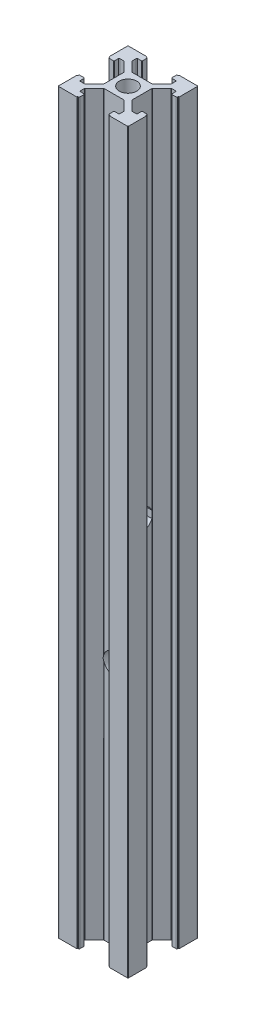
from build123d import *

# Parameters (mm, degrees)
SKETCH1_R               = 2.5
BOSS_EXTRUDE1_DEPTH     = 211
CUT_EXTRUDE1_DEPTH      = 10
CUT_EXTRUDE1_DEPTH_BACK = 10
CUT_EXTRUDE2_DEPTH      = 10
CUT_EXTRUDE2_DEPTH_BACK = 10
SKETCH4_R               = 3


with BuildPart() as part:
    # Sketch1 → Boss-Extrude1 (new body)
    with BuildSketch(Plane(origin=(0, 0, 0), x_dir=(1, 0, 0), z_dir=(0, 1, 0))):
        with BuildLine():
            Line((-10, 4.65), (-9.8, 4.65))
            Line((-9.8, 4.65), (-9.8, 4.4))
            ThreePointArc((-9.8, 4.4), (-9.741421356, 4.258578644), (-9.6, 4.2))
            Line((-9.6, 4.2), (-8.4, 4.2))
            ThreePointArc((-8.4, 4.2), (-8.258578644, 4.258578644), (-8.2, 4.4))
            Line((-8.2, 4.4), (-8.2, 5.45))
            ThreePointArc((-8.2, 5.45), (-8.141421356, 5.591421356), (-8, 5.65))
            Line((-8, 5.65), (-6.832842712, 5.65))
            ThreePointArc((-6.832842712, 5.65), (-6.756306026, 5.634775907), (-6.691421356, 5.591421356))
            Line((-6.691421356, 5.591421356), (-4.058578644, 2.958578644))
            ThreePointArc((-4.058578644, 2.958578644), (-4.015224093, 2.893693974), (-4, 2.817157288))
            Line((-4, 2.817157288), (-4, -2.817157288))
            ThreePointArc((-4, -2.817157288), (-4.015224093, -2.893693974), (-4.058578644, -2.958578644))
            Line((-4.058578644, -2.958578644), (-6.691421356, -5.591421356))
            ThreePointArc((-6.691421356, -5.591421356), (-6.756306026, -5.634775907), (-6.832842712, -5.65))
            Line((-6.832842712, -5.65), (-8, -5.65))
            ThreePointArc((-8, -5.65), (-8.141421356, -5.591421356), (-8.2, -5.45))
            Line((-8.2, -5.45), (-8.2, -4.4))
            ThreePointArc((-8.2, -4.4), (-8.258578644, -4.258578644), (-8.4, -4.2))
            Line((-8.4, -4.2), (-9.6, -4.2))
            ThreePointArc((-9.6, -4.2), (-9.741421356, -4.258578644), (-9.8, -4.4))
            Line((-9.8, -4.4), (-9.8, -4.65))
            Line((-9.8, -4.65), (-10, -4.65))
            Line((-10, -4.65), (-10, -9.8))
            ThreePointArc((-10, -9.8), (-9.941421356, -9.941421356), (-9.8, -10))
            Line((-9.8, -10), (-4.65, -10))
            Line((-4.65, -10), (-4.65, -9.8))
            Line((-4.65, -9.8), (-4.4, -9.8))
            ThreePointArc((-4.4, -9.8), (-4.258578644, -9.741421356), (-4.2, -9.6))
            Line((-4.2, -9.6), (-4.2, -8.4))
            ThreePointArc((-4.2, -8.4), (-4.258578644, -8.258578644), (-4.4, -8.2))
            Line((-4.4, -8.2), (-5.45, -8.2))
            ThreePointArc((-5.45, -8.2), (-5.591421356, -8.141421356), (-5.65, -8))
            Line((-5.65, -8), (-5.65, -6.832842712))
            ThreePointArc((-5.65, -6.832842712), (-5.634775907, -6.756306026), (-5.591421356, -6.691421356))
            Line((-5.591421356, -6.691421356), (-2.958578644, -4.058578644))
            ThreePointArc((-2.958578644, -4.058578644), (-2.893693974, -4.015224093), (-2.817157288, -4))
            Line((-2.817157288, -4), (2.817157288, -4))
            ThreePointArc((2.817157288, -4), (2.893693974, -4.015224093), (2.958578644, -4.058578644))
            Line((2.958578644, -4.058578644), (5.591421356, -6.691421356))
            ThreePointArc((5.591421356, -6.691421356), (5.634775907, -6.756306026), (5.65, -6.832842712))
            Line((5.65, -6.832842712), (5.65, -8))
            ThreePointArc((5.65, -8), (5.591421356, -8.141421356), (5.45, -8.2))
            Line((5.45, -8.2), (4.4, -8.2))
            ThreePointArc((4.4, -8.2), (4.258578644, -8.258578644), (4.2, -8.4))
            Line((4.2, -8.4), (4.2, -9.6))
            ThreePointArc((4.2, -9.6), (4.258578644, -9.741421356), (4.4, -9.8))
            Line((4.4, -9.8), (4.65, -9.8))
            Line((4.65, -9.8), (4.65, -10))
            Line((4.65, -10), (9.8, -10))
            ThreePointArc((9.8, -10), (9.941421356, -9.941421356), (10, -9.8))
            Line((10, -9.8), (10, -4.65))
            Line((10, -4.65), (9.8, -4.65))
            Line((9.8, -4.65), (9.8, -4.4))
            ThreePointArc((9.8, -4.4), (9.741421356, -4.258578644), (9.6, -4.2))
            Line((9.6, -4.2), (8.4, -4.2))
            ThreePointArc((8.4, -4.2), (8.258578644, -4.258578644), (8.2, -4.4))
            Line((8.2, -4.4), (8.2, -5.45))
            ThreePointArc((8.2, -5.45), (8.141421356, -5.591421356), (8, -5.65))
            Line((8, -5.65), (6.832842712, -5.65))
            ThreePointArc((6.832842712, -5.65), (6.756306026, -5.634775907), (6.691421356, -5.591421356))
            Line((6.691421356, -5.591421356), (4.058578644, -2.958578644))
            ThreePointArc((4.058578644, -2.958578644), (4.015224093, -2.893693974), (4, -2.817157288))
            Line((4, -2.817157288), (4, 2.817157288))
            ThreePointArc((4, 2.817157288), (4.015224093, 2.893693974), (4.058578644, 2.958578644))
            Line((4.058578644, 2.958578644), (6.691421356, 5.591421356))
            ThreePointArc((6.691421356, 5.591421356), (6.756306026, 5.634775907), (6.832842712, 5.65))
            Line((6.832842712, 5.65), (8, 5.65))
            ThreePointArc((8, 5.65), (8.141421356, 5.591421356), (8.2, 5.45))
            Line((8.2, 5.45), (8.2, 4.4))
            ThreePointArc((8.2, 4.4), (8.258578644, 4.258578644), (8.4, 4.2))
            Line((8.4, 4.2), (9.6, 4.2))
            ThreePointArc((9.6, 4.2), (9.741421356, 4.258578644), (9.8, 4.4))
            Line((9.8, 4.4), (9.8, 4.65))
            Line((9.8, 4.65), (10, 4.65))
            Line((10, 4.65), (10, 9.8))
            ThreePointArc((10, 9.8), (9.941421356, 9.941421356), (9.8, 10))
            Line((9.8, 10), (4.65, 10))
            Line((4.65, 10), (4.65, 9.8))
            Line((4.65, 9.8), (4.4, 9.8))
            ThreePointArc((4.4, 9.8), (4.258578644, 9.741421356), (4.2, 9.6))
            Line((4.2, 9.6), (4.2, 8.4))
            ThreePointArc((4.2, 8.4), (4.258578644, 8.258578644), (4.4, 8.2))
            Line((4.4, 8.2), (5.45, 8.2))
            ThreePointArc((5.45, 8.2), (5.591421356, 8.141421356), (5.65, 8))
            Line((5.65, 8), (5.65, 6.832842712))
            ThreePointArc((5.65, 6.832842712), (5.634775907, 6.756306026), (5.591421356, 6.691421356))
            Line((5.591421356, 6.691421356), (2.958578644, 4.058578644))
            ThreePointArc((2.958578644, 4.058578644), (2.893693974, 4.015224093), (2.817157288, 4))
            Line((2.817157288, 4), (-2.817157288, 4))
            ThreePointArc((-2.817157288, 4), (-2.893693974, 4.015224093), (-2.958578644, 4.058578644))
            Line((-2.958578644, 4.058578644), (-5.591421356, 6.691421356))
            ThreePointArc((-5.591421356, 6.691421356), (-5.634775907, 6.756306026), (-5.65, 6.832842712))
            Line((-5.65, 6.832842712), (-5.65, 8))
            ThreePointArc((-5.65, 8), (-5.591421356, 8.141421356), (-5.45, 8.2))
            Line((-5.45, 8.2), (-4.4, 8.2))
            ThreePointArc((-4.4, 8.2), (-4.258578644, 8.258578644), (-4.2, 8.4))
            Line((-4.2, 8.4), (-4.2, 9.6))
            ThreePointArc((-4.2, 9.6), (-4.258578644, 9.741421356), (-4.4, 9.8))
            Line((-4.4, 9.8), (-4.65, 9.8))
            Line((-4.65, 9.8), (-4.65, 10))
            Line((-4.65, 10), (-9.8, 10))
            ThreePointArc((-9.8, 10), (-9.941421356, 9.941421356), (-10, 9.8))
            Line((-10, 9.8), (-10, 4.65))
        make_face()
        Circle(SKETCH1_R, mode=Mode.SUBTRACT)
    extrude(amount=BOSS_EXTRUDE1_DEPTH)

    # Sketch2 → Cut-Extrude1 (cut, two sides: drawn at the far end of the back side and taken through both)
    with BuildSketch(Plane(origin=(4, 0, 0), x_dir=(0, 0, -1), z_dir=(1, 0, 0)).offset(-CUT_EXTRUDE1_DEPTH_BACK)):
        with BuildLine():
            ThreePointArc((2.817157288, 106.531321879), (0, 108.5), (-2.817157288, 106.531321879))
            Line((-2.817157288, 106.531321879), (-2.817157288, 104.468678121))
            ThreePointArc((-2.817157288, 104.468678121), (0, 102.5), (2.817157288, 104.468678121))
            Line((2.817157288, 104.468678121), (2.817157288, 106.531321879))
        make_face()
    extrude(amount=CUT_EXTRUDE1_DEPTH + CUT_EXTRUDE1_DEPTH_BACK, mode=Mode.SUBTRACT)

    # Sketch4 → Cut-Extrude2 (cut, two sides: drawn at the far end of the back side and taken through both)
    with BuildSketch(Plane.XY.offset(4).offset(-CUT_EXTRUDE2_DEPTH_BACK)):
        with Locations((0, 69.880973817)):
            Circle(SKETCH4_R)
    extrude(amount=CUT_EXTRUDE2_DEPTH + CUT_EXTRUDE2_DEPTH_BACK, mode=Mode.SUBTRACT)


solid = part.part
